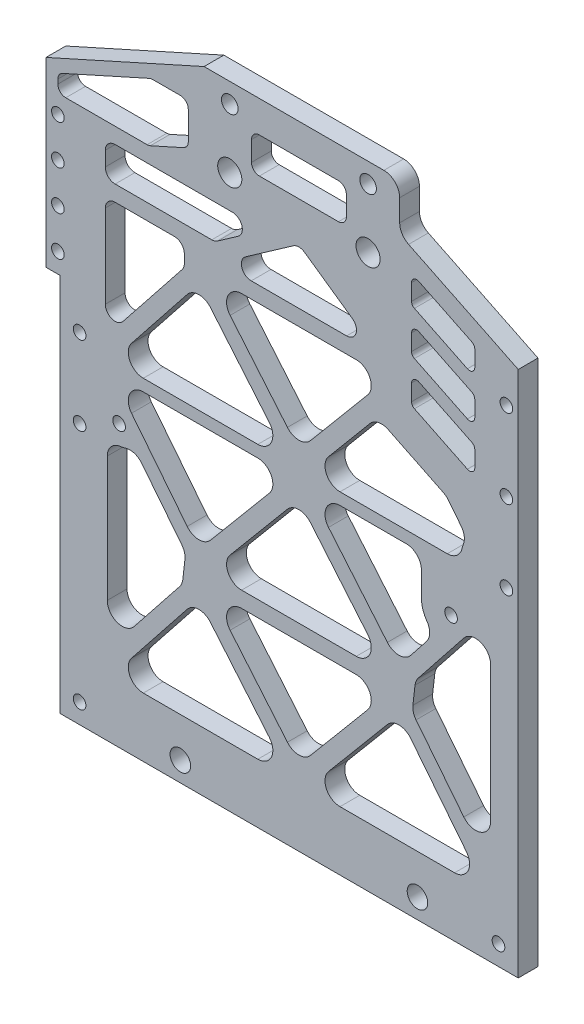
from build123d import *
from OCP.BRepFilletAPI import BRepFilletAPI_MakeChamfer

# Parameters (mm, degrees)
SKETCH_1_W                     = 111
SKETCH_1_H                     = 160
EXTRUDE_1_DEPTH                = 5
SKETCH_2_R                     = 2.6
CUT_EXTRUDE_1_DEPTH            = 98.49487166
SKETCH_6_R                     = 2.1
SKETCH_6_R_2                   = 3.0525
CUT_EXTRUDE_4_DEPTH            = 98.49487166
CUT_EXTRUDE_5_DEPTH            = 98.49487166
CUT_EXTRUDE_6_DEPTH            = 98.49487166
FILLET_1_R                     = 4
SKETCH_10_W                    = 8.5
SKETCH_10_H                    = 64
EXTRUDE_3_DEPTH                = 5
SKETCH_11_R                    = 1.6
CUT_EXTRUDE_7_DEPTH            = 103.571925984
CUT_EXTRUDE_8_DEPTH            = 103.571925984
SKETCH_13_W                    = 5
SKETCH_13_H                    = 96
EXTRUDE_4_DEPTH                = 5
SKETCH_19_R                    = 1.6
CUT_EXTRUDE_13_DEPTH           = 103.571925984
CUT_EXTRUDE_9_DEPTH            = 103.571925984
FILLET_2_R                     = 1.3
PATTERN_LINEAR_1_COUNT         = 3
PATTERN_LINEAR_1_PITCH         = 11
FILLET_2_OF_PATTERN_LINEAR_1_R = 1.3
CUT_EXTRUDE_11_DEPTH           = 103.571925984
CHAMFER_2_SIZE                 = 10
CHAMFER_2_SIZE2                = 4.500473212
FILLET_3_R                     = 2
SKETCH_21_R                    = 1.6
CUT_EXTRUDE_14_DEPTH           = 103.571925984
CUT_EXTRUDE_22_DEPTH           = 103.571925984
CHAMFER_1_SIZE                 = 4
CHAMFER_1_SIZE2                = 5.35926587
FILLET_5_R                     = 3.8
CUT_EXTRUDE_24_DEPTH           = 103.571925984
FILLET_6_R                     = 2.5


with BuildPart() as part:
    # 草图1 → 凸台-拉伸1 (new body)
    with BuildSketch(Plane.XY):
        Rectangle(SKETCH_1_W, SKETCH_1_H)
    extrude(amount=EXTRUDE_1_DEPTH)

    # 草图2 → 切除-拉伸1 (cut, through all)
    with BuildSketch(Plane.XY.offset(5)):
        with Locations((-30, -75)):
            Circle(SKETCH_2_R)
        with Locations(Location((30, -75, 0), (0, 0, 180))):
            Circle(SKETCH_2_R)
    extrude(amount=-CUT_EXTRUDE_1_DEPTH, mode=Mode.SUBTRACT)

    # 草图6 → 切除-拉伸4 (cut, through all)
    with BuildSketch(Plane.XY.offset(5)):
        with Locations((-17.5, 75)):
            Circle(SKETCH_6_R)
        with Locations((17.5, 75)):
            Circle(SKETCH_6_R)
        with Locations((17.5, 60)):
            Circle(SKETCH_6_R_2)
        with Locations((-17.5, 60)):
            Circle(SKETCH_6_R_2)
    extrude(amount=-CUT_EXTRUDE_4_DEPTH, mode=Mode.SUBTRACT)

    # 草图7 → 切除-拉伸5 (cut, through all)
    with BuildSketch(Plane.XY.offset(5)):
        with BuildLine():
            Line((10, 63), (-10, 63))
            ThreePointArc((-10, 63), (-11.414213562, 63.585786438), (-12, 65))
            Line((-12, 65), (-12, 70))
            ThreePointArc((-12, 70), (-11.414213562, 71.414213562), (-10, 72))
            Line((-10, 72), (10, 72))
            ThreePointArc((10, 72), (11.414213562, 71.414213562), (12, 70))
            Line((12, 70), (12, 65))
            ThreePointArc((12, 65), (11.414213562, 63.585786438), (10, 63))
        make_face()
    extrude(amount=-CUT_EXTRUDE_5_DEPTH, mode=Mode.SUBTRACT)

    # 草图8 → 切除-拉伸6 (cut, through all)
    with BuildSketch(Plane.XY.offset(5)):
        Polygon((25.5, 80), (25.5, 68), (55.5, 53.368022343), (55.5, 80), align=None)
    extrude(amount=-CUT_EXTRUDE_6_DEPTH, mode=Mode.SUBTRACT)

    # 圆角1
    fillet_1_edges = [part.edges().sort_by_distance(p)[0] for p in [
        (25.5, 80, 2.5),
        (25.5, 68, 2.5),
    ]]
    fillet(fillet_1_edges, radius=FILLET_1_R)

    # 草图10 → 凸台-拉伸3 (add)
    with BuildSketch(Plane.XY):
        with Locations((-59.75, 48)):
            Rectangle(SKETCH_10_W, SKETCH_10_H)
    extrude(amount=EXTRUDE_3_DEPTH)

    # 草图11 → 切除-拉伸7 (cut, through all)
    with BuildSketch(Plane.XY.offset(5)):
        with Locations((-61, 21)):
            Circle(SKETCH_11_R)
        with Locations((-61, 41)):
            Circle(SKETCH_11_R)
        with Locations((-61, 31)):
            Circle(SKETCH_11_R)
        with Locations((-61, 51)):
            Circle(SKETCH_11_R)
    extrude(amount=-CUT_EXTRUDE_7_DEPTH, mode=Mode.SUBTRACT)

    # 草图12 → 切除-拉伸8 (cut, through all)
    with BuildSketch(Plane.XY.offset(5)):
        Polygon((-64, 80), (-64, 62), (-24, 80), align=None)
    extrude(amount=-CUT_EXTRUDE_8_DEPTH, mode=Mode.SUBTRACT)

    # 草图13 → 凸台-拉伸4 (add)
    with BuildSketch(Plane.XY):
        with Locations((-58, -32)):
            Rectangle(SKETCH_13_W, SKETCH_13_H)
    extrude(amount=EXTRUDE_4_DEPTH)

    # 草图19 → 切除-拉伸13 (cut, through all)
    with BuildSketch(Plane.XY.offset(5)):
        with Locations((-55.5, -75)):
            Circle(SKETCH_19_R)
        with Locations((50.5, -75)):
            Circle(SKETCH_19_R)
        with Locations((-55.5, 6)):
            Circle(SKETCH_19_R)
        with Locations((-55.5, -14)):
            Circle(SKETCH_19_R)
        with Locations((52.5, 44)):
            Circle(SKETCH_19_R)
        with Locations((52.5, 24)):
            Circle(SKETCH_19_R)
        with Locations((52.5, 4)):
            Circle(SKETCH_19_R)
    extrude(amount=-CUT_EXTRUDE_13_DEPTH, mode=Mode.SUBTRACT)

    # 草图14 → 切除-拉伸9 (cut, through all)
    with BuildSketch(Plane.XY.offset(5)):
        Polygon((28.5, 60.973792532), (44.5, 53.170071115), (44.5, 46.170071115), (28.5, 53.973792532), align=None)
    cut_extrude_9 = extrude(amount=-CUT_EXTRUDE_9_DEPTH, mode=Mode.SUBTRACT)

    # 圆角2
    fillet_2_edges = [part.edges().sort_by_distance(p)[0] for p in [
        (28.5, 53.973792532, 2.5),
        (28.5, 60.973792532, 2.5),
        (44.5, 53.170071115, 2.5),
        (44.5, 46.170071115, 2.5),
    ]]
    fillet(fillet_2_edges, radius=FILLET_2_R)

    # 阵列(线性)1: 切除-拉伸9 ×3
    with Locations(*[(0, -i * PATTERN_LINEAR_1_PITCH, 0) for i in range(1, PATTERN_LINEAR_1_COUNT)]):
        add(cut_extrude_9, mode=Mode.SUBTRACT)

    # 圆角2 of 阵列(线性)1
    fillet_2_of_pattern_linear_1_edges = [part.edges().sort_by_distance(p)[0] for p in [
        (28.5, 42.973792532, 2.5),
        (28.5, 49.973792532, 2.5),
        (44.5, 42.170071115, 2.5),
        (44.5, 35.170071115, 2.5),
        (28.5, 31.973792532, 2.5),
        (28.5, 38.973792532, 2.5),
        (44.5, 31.170071115, 2.5),
        (44.5, 24.170071115, 2.5),
    ]]
    fillet(fillet_2_of_pattern_linear_1_edges, radius=FILLET_2_OF_PATTERN_LINEAR_1_R)

    # 草图17 → 切除-拉伸11 (cut, through all)
    with BuildSketch(Plane.XY.offset(5)):
        Polygon((-61, 60.06024317), (-37.444444444, 70.66024317), (-28, 70.66024317), (-28, 55.66024317), (-61, 55.66024317), align=None)
    extrude(amount=-CUT_EXTRUDE_11_DEPTH, mode=Mode.SUBTRACT)

    # 倒角2
    chamfer_2_edges = [part.edges().sort_by_distance(p)[0] for p in [
        (-28, 55.66024317, 2.5),
    ]]
    chamfer_2_side = [part.faces().sort_by_distance(p)[0] for p in [
        (-44.5, 55.66024317, 2.5),
    ]]
    chamfer(chamfer_2_edges, length=CHAMFER_2_SIZE, length2=CHAMFER_2_SIZE2, reference=chamfer_2_side[0])

    # 圆角3
    fillet_3_edges = [part.edges().sort_by_distance(p)[0] for p in [
        (-61, 55.66024317, 2.5),
        (-61, 60.06024317, 2.5),
        (-37.444444444, 70.66024317, 2.5),
        (-28, 70.66024317, 2.5),
        (-28, 60.160716382, 2.5),
        (-38, 55.66024317, 2.5),
    ]]
    fillet(fillet_3_edges, radius=FILLET_3_R)

    # 草图21 → 切除-拉伸14 (cut, through all)
    with BuildSketch(Plane.XY.offset(5)):
        with Locations((-45.5, -9)):
            Circle(SKETCH_21_R)
        with Locations(Location((38.5, -9, 0), (0, 0, 180))):
            Circle(SKETCH_21_R)
    extrude(amount=-CUT_EXTRUDE_14_DEPTH, mode=Mode.SUBTRACT)

    # 草图20 → 切除-拉伸22 (cut, through all)
    with BuildSketch(Plane(origin=(0, 0, 0), x_dir=(-1, 0, 0), z_dir=(0, 0, -1))):
        Polygon((0, -61), (22.655690042, -34), (-22.655690042, -34), align=None)
        Polygon((-47.25, -65), (-2.25, -65), (-25.380355442, -37.434315805), align=None)
        Polygon((2.25, -65), (47.25, -65), (25.380355442, -37.434315805), align=None)
        Polygon((-22.655690042, -30), (22.655690042, -30), (0, -3), align=None)
        with BuildLine():
            Line((-34.356579614, -15.251565205), (-25.380355442, -26.565684195))
            Line((-25.380355442, -26.565684195), (-2.25, 1))
            Line((-2.25, 1), (-31, 1))
            Line((-31, 1), (-31, -9))
            ThreePointArc((-31, -9), (-31.892214709, -12.547840689), (-34.356579614, -15.251565205))
        make_face()
        Polygon((-48.5, -60.13973716), (-26.174922004, -32), (-48.5, -3.86026284), align=None)
        with BuildLine():
            ThreePointArc((-42.515400931, 9.967745035), (-41.287323092, 7.095492841), (-40.867880702, 4))
            Line((-40.867880702, 4), (-2.25, 4))
            Line((-2.25, 4), (-19.904657662, 25.040001695))
            Line((-19.904657662, 25.040001695), (-37.281613588, 16.564694))
            Line((-37.281613588, 16.564694), (-42.515400931, 9.967745035))
        make_face()
        Polygon((25.380355442, -26.565684195), (47.25, 1), (31, 1), (2.25, 1), align=None)
        with BuildLine():
            ThreePointArc((48.5, -12.803528854), (45.069385206, -13.825080584), (41.87388234, -12.212180328))
            Line((41.87388234, -12.212180328), (26.174922004, -32))
            Line((26.174922004, -32), (48.5, -60.13973716))
            Line((48.5, -60.13973716), (48.5, -12.803528854))
        make_face()
        Polygon((47.25, 4), (25.380355442, 31.565684195), (2.25, 4), align=None)
        Polygon((0, 8), (22.655690042, 35), (-22.655690042, 35), align=None)
    extrude(amount=-CUT_EXTRUDE_22_DEPTH, mode=Mode.SUBTRACT)

    # 倒角1: one chamfer whose edges measure the first distance from different faces: ONE call of the kernel's chamfer builder (chamfer() names one face for all edges)
    chamfer_1_edges_1 = [part.edges().sort_by_distance(p)[0] for p in [
        (-26.174922004, -32, 2.5),
    ]]
    chamfer_1_side_1 = [part.faces().sort_by_distance(p)[0] for p in [
        (-34.024402172, -22.106090164, 2.5),
    ]]
    chamfer_1_edges_2 = [part.edges().sort_by_distance(p)[0] for p in [
        (26.174922004, -32, 2.5),
    ]]
    chamfer_1_side_2 = [part.faces().sort_by_distance(p)[0] for p in [
        (37.337461002, -46.06986858, 2.5),
    ]]
    chamfer_1 = BRepFilletAPI_MakeChamfer(part.part.solid().wrapped)
    for e in chamfer_1_edges_1:
        chamfer_1.Add(CHAMFER_1_SIZE, CHAMFER_1_SIZE2, e.wrapped, chamfer_1_side_1[0].wrapped)  # the first distance lies on this face
    for e in chamfer_1_edges_2:
        chamfer_1.Add(CHAMFER_1_SIZE, CHAMFER_1_SIZE2, e.wrapped, chamfer_1_side_2[0].wrapped)  # the first distance lies on this face
    add(Compound.cast(chamfer_1.Shape()), mode=Mode.REPLACE)

    # 圆角5
    fillet_5_edges = [part.edges().sort_by_distance(p)[0] for p in [
        (-2.25, 1, 2.5),
        (-47.25, 1, 2.5),
        (-25.380355442, -26.565684195, 2.5),
        (-47.25, 4, 2.5),
        (-2.25, 4, 2.5),
        (-25.380355442, 31.565684195, 2.5),
        (40.867880702, 4, 2.5),
        (42.515400931, 9.967745035, 2.5),
        (37.281613588, 16.564694, 2.5),
        (19.904657662, 25.040001695, 2.5),
        (2.25, 4, 2.5),
        (-22.655690042, 35, 2.5),
        (0, 8, 2.5),
        (22.655690042, 35, 2.5),
        (-2.25, -65, 2.5),
        (-25.380355442, -37.434315805, 2.5),
        (-47.25, -65, 2.5),
        (-41.87388234, -12.212180328, 2.5),
        (-48.5, -12.803528854, 2.5),
        (-48.5, -60.13973716, 2.5),
        (-22.655690042, -34, 2.5),
        (0, -61, 2.5),
        (22.655690042, -34, 2.5),
        (-22.655690042, -30, 2.5),
        (22.655690042, -30, 2.5),
        (0, -3, 2.5),
        (48.5, -3.86026284, 2.5),
        (48.5, -60.13973716, 2.5),
        (34.356579614, -15.251565205, 2.5),
        (31, 1, 2.5),
        (2.25, 1, 2.5),
        (25.380355442, -26.565684195, 2.5),
        (47.25, -65, 2.5),
        (25.380355442, -37.434315805, 2.5),
        (2.25, -65, 2.5),
        (-29.505815104, -36.198438023, 2.5),
        (-28.661003628, -28.866408106, 2.5),
        (29.505815104, -27.801561977, 2.5),
        (28.661003628, -35.133591894, 2.5),
    ]]
    fillet(fillet_5_edges, radius=FILLET_5_R)

    # 草图24 → 切除-拉伸24 (cut, through all)
    with BuildSketch(Plane(origin=(0, 0, 0), x_dir=(-1, 0, 0), z_dir=(0, 0, -1))):
        Polygon((49, 39), (49, 8.230035766), (29, 33.439118723), (29, 39), align=None)
        Polygon((-20, 39), (0, 53), (20, 39), align=None)
        Polygon((8.889112966, 51.66024317), (21.260888923, 43), (49, 43), (49, 51.66024317), align=None)
    extrude(amount=-CUT_EXTRUDE_24_DEPTH, mode=Mode.SUBTRACT)

    # 圆角6
    fillet_6_edges = [part.edges().sort_by_distance(p)[0] for p in [
        (-20, 39, 2.5),
        (20, 39, 2.5),
        (0, 53, 2.5),
        (-8.889112966, 51.66024317, 2.5),
        (-49, 51.66024317, 2.5),
        (-49, 43, 2.5),
        (-21.260888923, 43, 2.5),
        (-29, 39, 2.5),
        (-49, 39, 2.5),
        (-49, 8.230035766, 2.5),
        (-29, 33.439118723, 2.5),
    ]]
    fillet(fillet_6_edges, radius=FILLET_6_R)


solid = part.part
